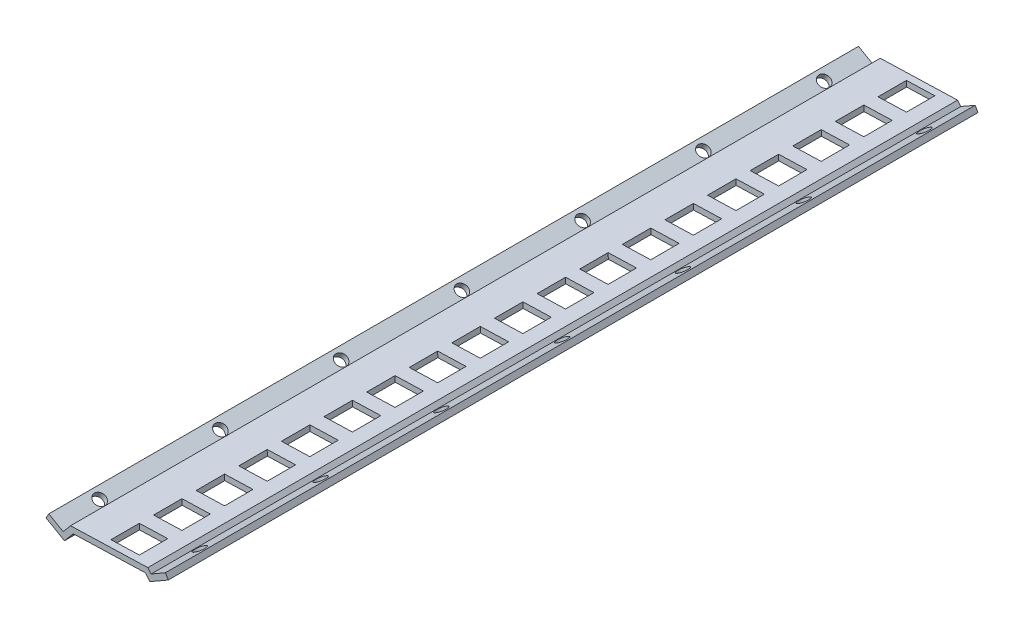
from build123d import *

# Parameters (mm, degrees)
BOSS_EXTRUDE1_DEPTH = 171
SKETCH2_R           = 1.25
CUT_EXTRUDE1_DEPTH  = 10
SKETCH4_R           = 1.25
CUT_EXTRUDE2_DEPTH  = 10
LPATTERN1_COUNT     = 7
LPATTERN1_PITCH     = 25.5
SKETCH5_W           = 6
SKETCH5_H           = 6
CUT_EXTRUDE3_DEPTH  = 10
LPATTERN2_COUNT     = 19
LPATTERN2_PITCH     = 9


with BuildPart() as part:
    # Sketch1 → Boss-Extrude1 (new body)
    with BuildSketch(Plane.XY):
        Polygon((-7.560747901, -2.297203345), (8.76644945, -1.788652997), (9.457807768, -2.612581756), (12.482904169, -0.866041535), (13.082904169, -1.905272019), (9.185789852, -4.155272019), (8.221608437, -3.006205355), (-6.986662858, -3.479904024), (-8.845450789, -5.695121219), (-12.742565106, -3.445121219), (-12.142565106, -2.405890734), (-9.117468705, -4.152430955), align=None)
    extrude(amount=BOSS_EXTRUDE1_DEPTH)

    # Sketch2 → Cut-Extrude1 (cut)
    with BuildSketch(Plane(origin=(3.495733027, -6.054787213, 0), x_dir=(0.8660254037844403, 0.49999999999999734, 0), z_dir=(-0.49999999999999734, 0.8660254037844403, 0))):
        with Locations(Location((8.377491356, -162, 0), (0, 0, 180))):
            Circle(SKETCH2_R)
    cut_extrude1 = extrude(amount=-CUT_EXTRUDE1_DEPTH, mode=Mode.SUBTRACT)

    # Sketch4 → Cut-Extrude2 (cut)
    with BuildSketch(Plane(origin=(-4.077422524, -7.062302975, 0), x_dir=(0.8660254037844392, -0.49999999999999917, 0), z_dir=(0.49999999999999917, 0.8660254037844392, 0))):
        with Locations(Location((-7.312824482, -162, 0), (0, 0, 180))):
            Circle(SKETCH4_R)
    cut_extrude2 = extrude(amount=-CUT_EXTRUDE2_DEPTH, mode=Mode.SUBTRACT)

    # LPattern1: Cut-Extrude1, Cut-Extrude2 ×7
    with Locations(*[(0, 0, -i * LPATTERN1_PITCH) for i in range(1, LPATTERN1_COUNT)]):
        add(cut_extrude1, mode=Mode.SUBTRACT)
        add(cut_extrude2, mode=Mode.SUBTRACT)

    # Sketch5 → Cut-Extrude3 (cut)
    with BuildSketch(Plane(origin=(0.064154599, -2.059707176, 0), x_dir=(0.9995152712604761, 0.031132338766899612, 0), z_dir=(-0.031132338766899612, 0.9995152712604761, 0))):
        with Locations((2.406515149, -166.5)):
            Rectangle(SKETCH5_W, SKETCH5_H)
    cut_extrude3 = extrude(amount=-CUT_EXTRUDE3_DEPTH, mode=Mode.SUBTRACT)

    # LPattern2: Cut-Extrude3 ×19
    with Locations(*[(0, 0, -i * LPATTERN2_PITCH) for i in range(1, LPATTERN2_COUNT)]):
        add(cut_extrude3, mode=Mode.SUBTRACT)


solid = part.part
